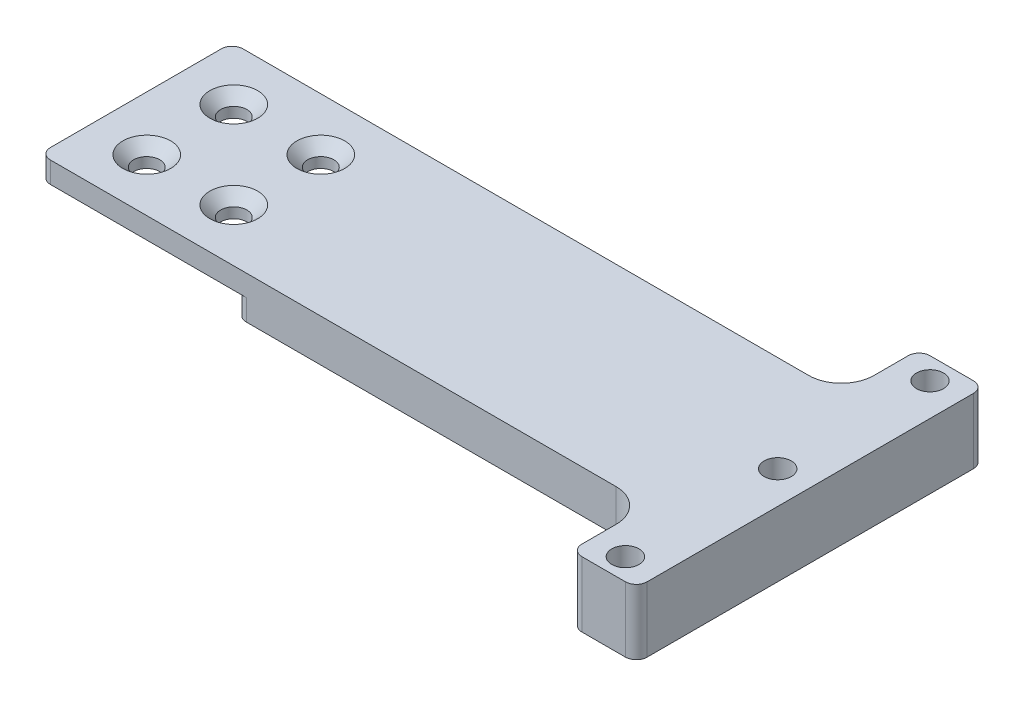
from build123d import *

# Parameters (mm, degrees)
BOSS_EXTRUDE1_DEPTH                                 = 3.9
BOSS_EXTRUDE2_DEPTH                                 = 2.1
CSK_FOR_M2_COUNTERSUNK_FLAT_HEAD_SCREW1_D           = 2.4
CSK_FOR_M2_COUNTERSUNK_FLAT_HEAD_SCREW1_CSINK_D     = 4.4
CSK_FOR_M2_COUNTERSUNK_FLAT_HEAD_SCREW1_CSINK_ANGLE = 90
LPATTERN1_COUNT                                     = 2
LPATTERN1_PITCH                                     = 8
LPATTERN1_COUNT_DIR2                                = 2
LPATTERN1_PITCH_DIR2                                = 8
SKETCH7_W                                           = 8
SKETCH7_H                                           = 6
CUT_EXTRUDE1_DEPTH                                  = 36.397740041
SKETCH10_W                                          = 18
SKETCH10_H                                          = 18
CUT_EXTRUDE2_DEPTH                                  = 1.95
SKETCH14_W                                          = 8
SKETCH14_H                                          = 1
CUT_EXTRUDE3_DEPTH                                  = 36.11983058
M3_TAPPED_HOLE1_D                                   = 2.5
M3_TAPPED_HOLE1_DEPTH                               = 6.748924226
M3_TAPPED_HOLE1_TIP                                 = 0.751075774
SKETCH15_W                                          = 56
SKETCH15_H                                          = 3.05
CUT_EXTRUDE4_DEPTH                                  = 36.397740041
FILLET5_R                                           = 1
FILLET7_R                                           = 3


with BuildPart() as part:
    # Sketch1 → Boss-Extrude1 (new body)
    with BuildSketch(Plane(origin=(0, 0, 0), x_dir=(1, 0, 0), z_dir=(0, 1, 0))):
        Polygon((22, 11.9), (25, 11.9), (25, 16), (28, 16), (31, 16), (31, -16), (28, -16), (25, -16), (25, -11.9), (22, -11.9), (-31, -11.9), (-31, 11.9), align=None)
    extrude(amount=BOSS_EXTRUDE1_DEPTH)

    # Sketch6 → Boss-Extrude2 (add)
    with BuildSketch(Plane.XZ):
        Polygon((25, 11.9), (25, 16), (28, 16), (31, 16), (31, -16), (28, -16), (25, -16), (25, -11.9), align=None)
    extrude(amount=BOSS_EXTRUDE2_DEPTH)

    # CSK for M2 Countersunk Flat Head Screw1 (through all)
    with Locations(Plane(origin=(0, 3.9, 0), x_dir=(1, 0, 0), z_dir=(0, 1, 0))):
        with Locations((-18, 4)):
            csk_for_m2_countersunk_flat_head_screw1 = CounterSinkHole(CSK_FOR_M2_COUNTERSUNK_FLAT_HEAD_SCREW1_D / 2, CSK_FOR_M2_COUNTERSUNK_FLAT_HEAD_SCREW1_CSINK_D / 2, counter_sink_angle=CSK_FOR_M2_COUNTERSUNK_FLAT_HEAD_SCREW1_CSINK_ANGLE)

    # LPattern1: CSK for M2 Countersunk Flat Head Screw1 2 × 2
    with Locations(*[(-i * LPATTERN1_PITCH, 0, j * LPATTERN1_PITCH_DIR2) for i in range(LPATTERN1_COUNT) for j in range(LPATTERN1_COUNT_DIR2) if (i, j) != (0, 0)]):
        add(csk_for_m2_countersunk_flat_head_screw1, mode=Mode.SUBTRACT)

    # Sketch7 → Cut-Extrude1 (cut, through all)
    with BuildSketch(Plane(origin=(0, 3.9, 0), x_dir=(1, 0, 0), z_dir=(0, 1, 0))):
        with Locations((-27, 12)):
            Rectangle(SKETCH7_W, SKETCH7_H)
        with Locations((-27, -12)):
            Rectangle(SKETCH7_W, SKETCH7_H)
    extrude(amount=-CUT_EXTRUDE1_DEPTH, mode=Mode.SUBTRACT)

    # Sketch10 → Cut-Extrude2 (cut)
    with BuildSketch(Plane.XZ):
        with Locations((-22, 0)):
            Rectangle(SKETCH10_W, SKETCH10_H)
    extrude(amount=-CUT_EXTRUDE2_DEPTH, mode=Mode.SUBTRACT)

    # Sketch14 → Cut-Extrude3 (cut, through all)
    with BuildSketch(Plane.XZ.offset(-1.95)):
        with Locations((-27, -9.45)):
            Rectangle(SKETCH14_W, SKETCH14_H)
        with Locations((-27, 9.45)):
            Rectangle(SKETCH14_W, SKETCH14_H)
    extrude(amount=-CUT_EXTRUDE3_DEPTH, mode=Mode.SUBTRACT)

    # M3 Tapped Hole1
    with Locations(Plane(origin=(0, 3.9, 0), x_dir=(1, 0, 0), z_dir=(0, 1, 0))):
        with Locations((28, 14), (28, -14), (28, 0)):
            Hole(M3_TAPPED_HOLE1_D / 2, depth=M3_TAPPED_HOLE1_DEPTH)
            with Locations((0, 0, -(M3_TAPPED_HOLE1_DEPTH + M3_TAPPED_HOLE1_TIP / 2))):  # 118° drill point
                Cone(0, M3_TAPPED_HOLE1_D / 2, M3_TAPPED_HOLE1_TIP, mode=Mode.SUBTRACT)

    # Sketch15 → Cut-Extrude4 (cut, through all)
    with BuildSketch(Plane(origin=(0, 3.9, 0), x_dir=(1, 0, 0), z_dir=(0, 1, 0))):
        with Locations((-3, 10.375)):
            Rectangle(SKETCH15_W, SKETCH15_H)
        with Locations((-3, -10.375)):
            Rectangle(SKETCH15_W, SKETCH15_H)
    extrude(amount=-CUT_EXTRUDE4_DEPTH, mode=Mode.SUBTRACT)

    # Fillet5
    fillet5_edges = [part.edges().sort_by_distance(p)[0] for p in [
        (25, 0.9, -16),
        (31, 0.9, -16),
        (31, 0.9, 16),
        (25, 0.9, 16),
        (-13, 0.975, 8.85),
        (-13, 0.975, -8.85),
        (-31, 2.925, -8.85),
        (-31, 2.925, 8.85),
    ]]
    fillet(fillet5_edges, radius=FILLET5_R)

    # Fillet7
    fillet7_edges = [part.edges().sort_by_distance(p)[0] for p in [
        (25, 1.95, -8.85),
        (25, 1.95, 8.85),
    ]]
    fillet(fillet7_edges, radius=FILLET7_R)


solid = part.part
